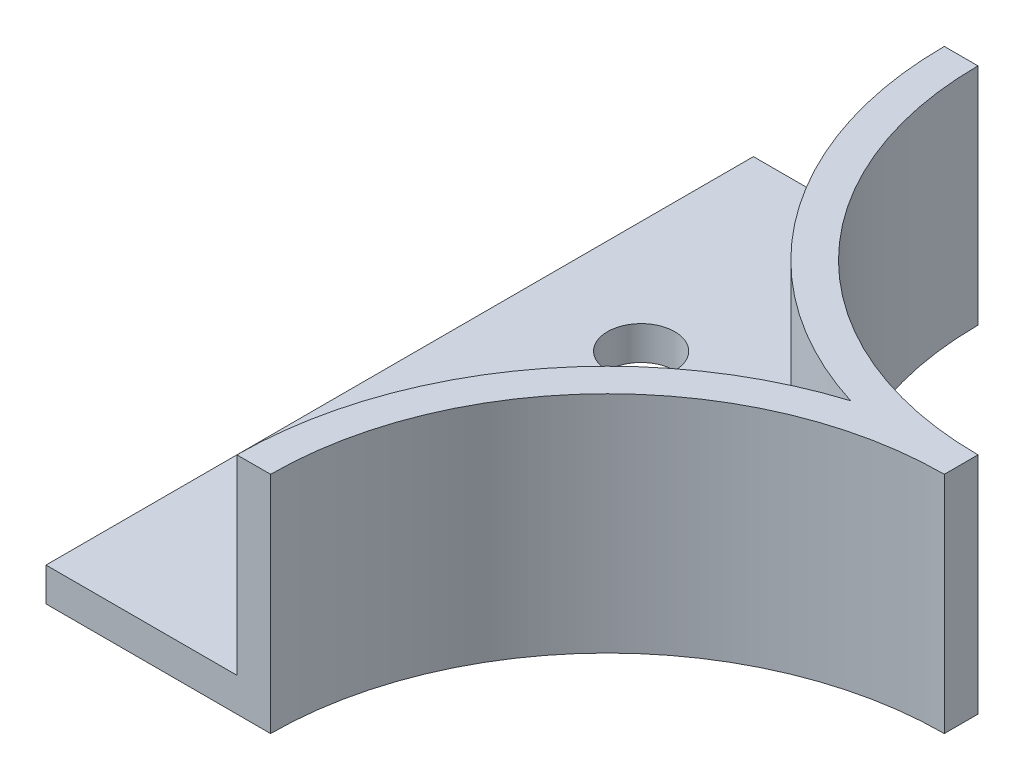
from build123d import *

# Parameters (mm, degrees)
EXTRUDE_1_DEPTH     = 20
CUT_EXTRUDE_1_DEPTH = 17
SKETCH_4_R          = 3
CUT_EXTRUDE_2_DEPTH = 62.491869381


with BuildPart() as part:
    # 草圖2 → 填料-伸長1 (new body)
    with BuildSketch(Plane(origin=(0, 0, 0), x_dir=(1, 0, 0), z_dir=(0, 1, 0))):
        with BuildLine():
            Line((0, 31.5), (20, 31.5))
            ThreePointArc((20, 31.5), (28.786796564, 10.286796564), (50, 1.5))
            Line((50, 1.5), (50, 0))
            Line((50, 0), (0, 0))
            Line((0, 0), (0, 31.5))
        make_face()
    extrude_1 = extrude(amount=EXTRUDE_1_DEPTH)

    # 草圖3 → 除料-伸長1 (cut)
    with BuildSketch(Plane(origin=(0, 20, 0), x_dir=(1, 0, 0), z_dir=(0, 1, 0))):
        with BuildLine():
            Line((0, 31.5), (17, 31.5))
            ThreePointArc((17, 31.5), (23.414353431, 11.949977071), (40.163842214, 0))
            Line((40.163842214, 0), (0, 0))
            Line((0, 0), (0, 31.5))
        make_face()
    cut_extrude_1 = extrude(amount=-CUT_EXTRUDE_1_DEPTH, mode=Mode.SUBTRACT)

    # 草圖4 → 除料-伸長2 (cut, through all)
    with BuildSketch(Plane(origin=(0, 3, 0), x_dir=(1, 0, 0), z_dir=(0, 1, 0))):
        with Locations(Location((10, 11.5, 0), (0, 0, 270))):
            Circle(SKETCH_4_R)
    cut_extrude_2 = extrude(amount=-CUT_EXTRUDE_2_DEPTH, mode=Mode.SUBTRACT)

    # 鏡射4: 填料-伸長1, 除料-伸長1, 除料-伸長2 across plane
    add(extrude_1.mirror(Plane.XY))
    add(cut_extrude_1.mirror(Plane.XY), mode=Mode.SUBTRACT)
    add(cut_extrude_2.mirror(Plane.XY), mode=Mode.SUBTRACT)


solid = part.part
